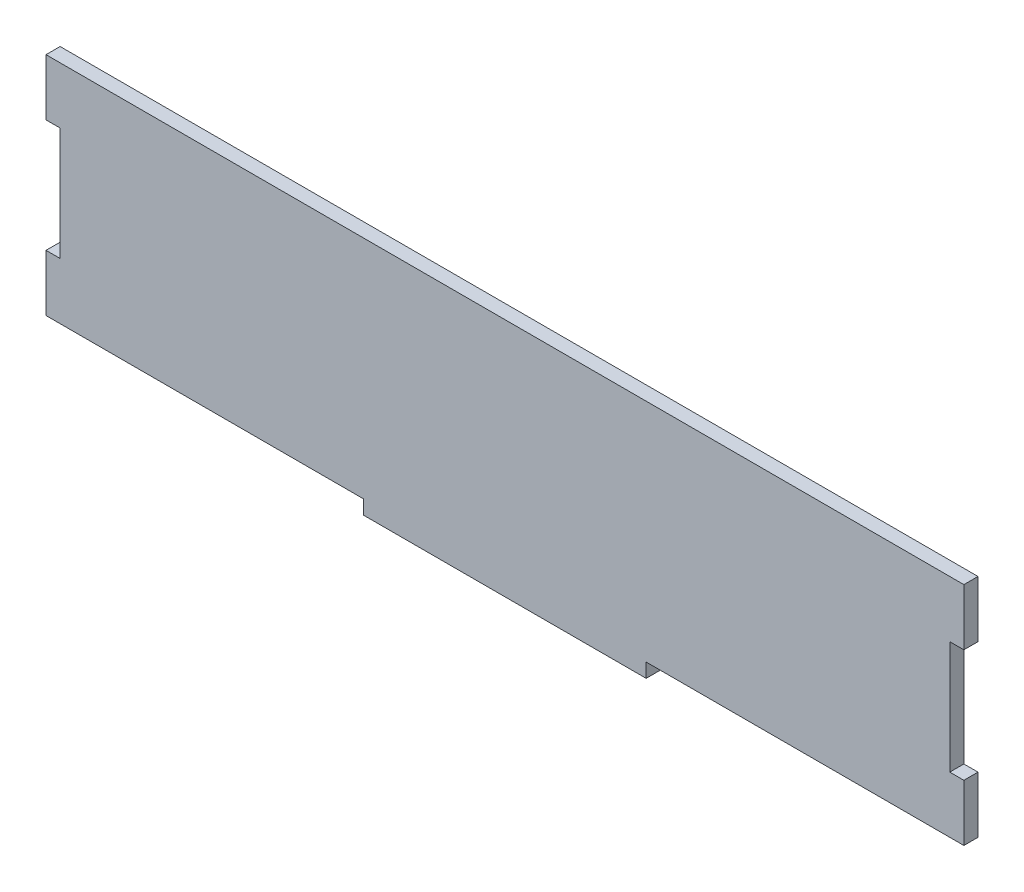
from build123d import *

# Parameters (mm, degrees)
SKIZZE1_W                       = 325
SKIZZE1_H                       = 80
AUFSATZ_LINEAR_AUSTRAGEN1_DEPTH = 5
SKIZZE2_W                       = 100
SKIZZE2_H                       = 5
AUFSATZ_LINEAR_AUSTRAGEN3_DEPTH = 5
SKIZZE3_W                       = 5
SKIZZE3_H                       = 40
SCHNITT_LINEAR_AUSTRAGEN1_DEPTH = 335.738704066


with BuildPart() as part:
    # Skizze1 → Aufsatz-Linear austragen1 (new body)
    with BuildSketch(Plane.XY):
        with Locations((162.5, 40)):
            Rectangle(SKIZZE1_W, SKIZZE1_H)
    extrude(amount=AUFSATZ_LINEAR_AUSTRAGEN1_DEPTH)

    # Skizze2 → Aufsatz-Linear austragen3 (add, through all)
    with BuildSketch(Plane.XY.offset(5)):
        with Locations((162.5, -2.5)):
            Rectangle(SKIZZE2_W, SKIZZE2_H)
    extrude(amount=-AUFSATZ_LINEAR_AUSTRAGEN3_DEPTH)

    # Skizze3 → Schnitt-Linear austragen1 (cut, through all)
    with BuildSketch(Plane.XY.offset(5)):
        with Locations((2.5, 40)):
            Rectangle(SKIZZE3_W, SKIZZE3_H)
        with Locations((322.5, 40)):
            Rectangle(SKIZZE3_W, SKIZZE3_H)
    extrude(amount=-SCHNITT_LINEAR_AUSTRAGEN1_DEPTH, mode=Mode.SUBTRACT)


solid = part.part
